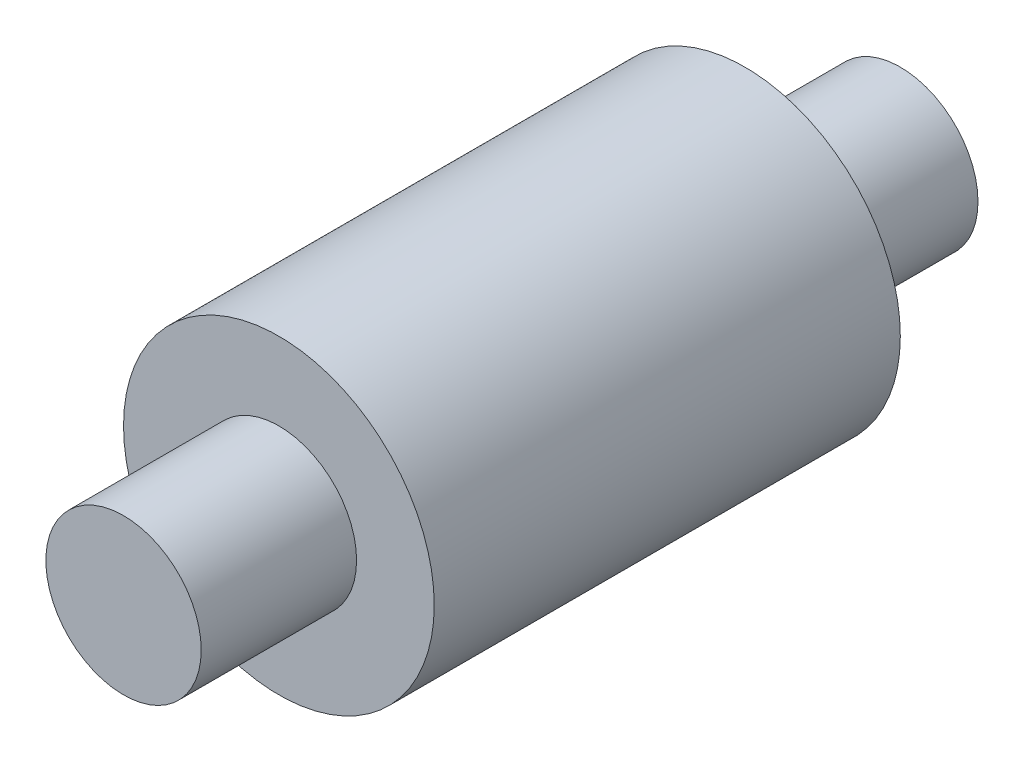
from build123d import *

# Parameters (mm, degrees)
SALIENTE_EXTRUIR1_DEPTH      = 5
SALIENTE_EXTRUIR1_DEPTH_BACK = 5
CROQUIS1_R                   = 1
SALIENTE_EXTRUIR2_DEPTH      = 3
SALIENTE_EXTRUIR2_DEPTH_BACK = 3
CROQUIS2_R                   = 2


with BuildPart() as part:
    # Croquis1 → Saliente-Extruir1 (new, two sides: drawn at the far end of the back side and taken through both)
    with BuildSketch(Plane.XY.offset(-SALIENTE_EXTRUIR1_DEPTH_BACK)):
        Circle(CROQUIS1_R)
    extrude(amount=SALIENTE_EXTRUIR1_DEPTH + SALIENTE_EXTRUIR1_DEPTH_BACK)

    # Croquis2 → Saliente-Extruir2 (add, two sides: drawn at the far end of the back side and taken through both)
    with BuildSketch(Plane.XY.offset(-SALIENTE_EXTRUIR2_DEPTH_BACK)):
        Circle(CROQUIS2_R)
    extrude(amount=SALIENTE_EXTRUIR2_DEPTH + SALIENTE_EXTRUIR2_DEPTH_BACK)


solid = part.part
